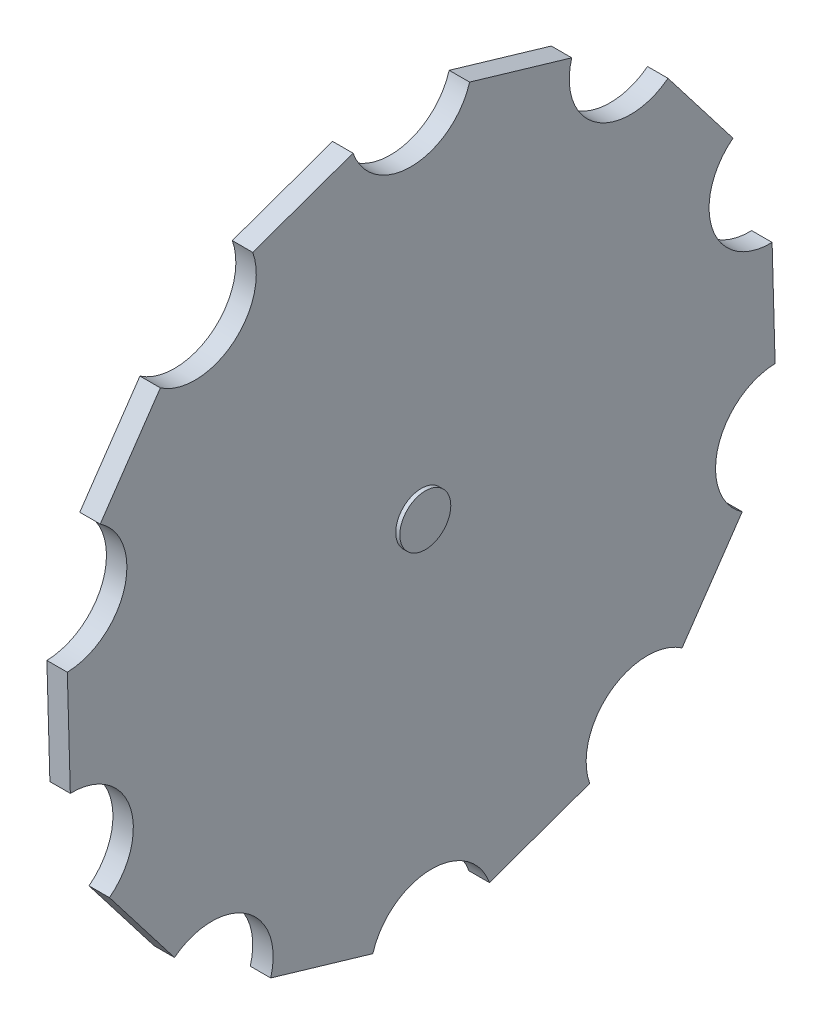
from build123d import *

# Parameters (mm, degrees)
DODANIE_WYCI_GNI_CIE1_DEPTH = 5
SZKIC2_R                    = 6.235949903
DODANIE_WYCI_GNI_CIE2_DEPTH = 1


with BuildPart() as part:
    # Szkic1 → Dodanie-wyciągnięcie1 (new body)
    with BuildSketch(Plane(origin=(0, 0, 0), x_dir=(0, 0, -1), z_dir=(1, 0, 0))):
        with BuildLine():
            Line((16.683684026, -85.628014752), (41.227039969, -76.881944554))
            ThreePointArc((41.227039969, -76.881944554), (46.201703182, -59.964643396), (63.82826816, -59.468095705))
            Line((63.82826816, -59.468095705), (78.543449139, -37.966153615))
            ThreePointArc((78.543449139, -37.966153615), (72.624296091, -21.355735808), (86.5926233, -10.593385344))
            Line((86.5926233, -10.593385344), (85.858930332, 15.451417583))
            ThreePointArc((85.858930332, 15.451417583), (71.306876302, 25.410337004), (76.281539514, 42.327638162))
            Line((76.281539514, 42.327638162), (60.379218375, 62.967072438))
            ThreePointArc((60.379218375, 62.967072438), (42.752653397, 62.470524746), (36.833500348, 79.080942553))
            Line((36.833500348, 79.080942553), (11.836697213, 86.431445794))
            ThreePointArc((11.836697213, 86.431445794), (-2.131629996, 75.669095331), (-16.683684026, 85.628014752))
            Line((-16.683684026, 85.628014752), (-41.227039969, 76.881944554))
            ThreePointArc((-41.227039969, 76.881944554), (-46.201703182, 59.964643396), (-63.82826816, 59.468095705))
            Line((-63.82826816, 59.468095705), (-78.543449139, 37.966153615))
            ThreePointArc((-78.543449139, 37.966153615), (-72.624296091, 21.355735808), (-86.5926233, 10.593385344))
            Line((-86.5926233, 10.593385344), (-85.858930332, -15.451417583))
            ThreePointArc((-85.858930332, -15.451417583), (-71.306876302, -25.410337004), (-76.281539514, -42.327638162))
            Line((-76.281539514, -42.327638162), (-60.379218375, -62.967072438))
            ThreePointArc((-60.379218375, -62.967072438), (-42.752653397, -62.470524746), (-36.833500348, -79.080942553))
            Line((-36.833500348, -79.080942553), (-11.836697213, -86.431445794))
            ThreePointArc((-11.836697213, -86.431445794), (2.131629996, -75.669095331), (16.683684026, -85.628014752))
        make_face()
    extrude(amount=DODANIE_WYCI_GNI_CIE1_DEPTH)

    # Szkic2 → Dodanie-wyciągnięcie2 (add)
    with BuildSketch(Plane(origin=(5, 0, 0), x_dir=(0, 0, -1), z_dir=(1, 0, 0))):
        Circle(SZKIC2_R)
    extrude(amount=DODANIE_WYCI_GNI_CIE2_DEPTH)


solid = part.part
